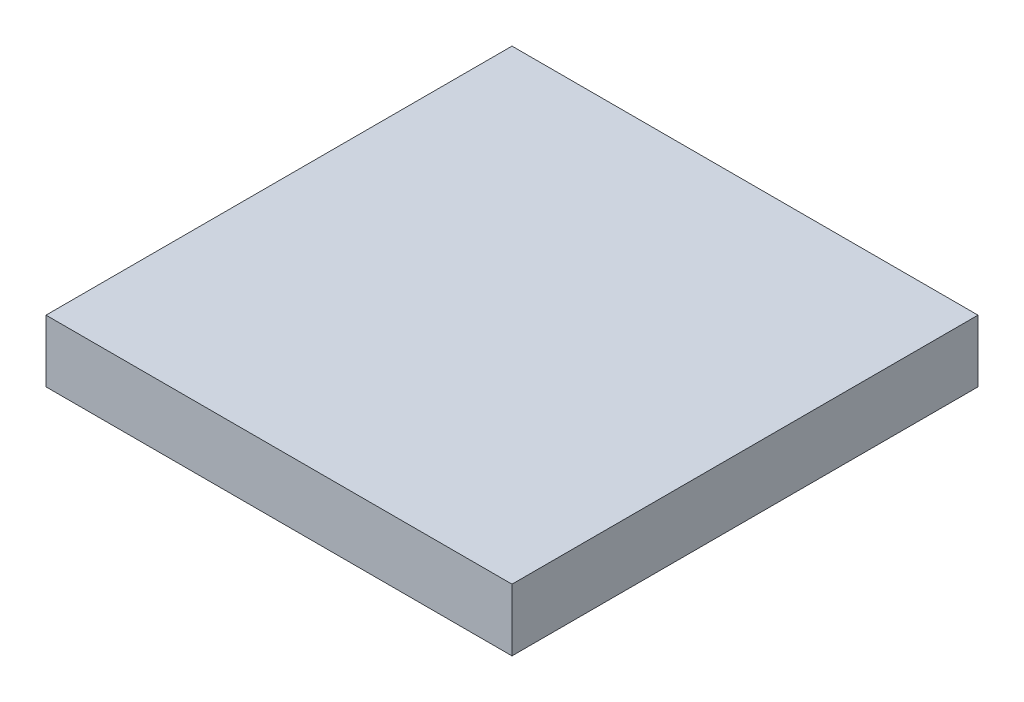
from build123d import *

# Parameters (mm, degrees)
SKETCH1_W           = 15
SKETCH1_H           = 15
BOSS_EXTRUDE1_DEPTH = 2
SKETCH4_W           = 1.6
SKETCH4_H           = 3
BOSS_EXTRUDE2_DEPTH = 2


with BuildPart() as part:
    # Sketch1 → Boss-Extrude1 (new body)
    with BuildSketch(Plane(origin=(0, 0, 0), x_dir=(1, 0, 0), z_dir=(0, 1, 0))):
        with Locations((-0.107629188, -0.080708285)):
            Rectangle(SKETCH1_W, SKETCH1_H)
    extrude(amount=BOSS_EXTRUDE1_DEPTH)

    # Sketch4 → Boss-Extrude2 (add)
    with BuildSketch(Plane(origin=(0, 0, 0), x_dir=(1, 0, 0), z_dir=(0, 1, 0))):
        with Locations((3.392370812, -0.080708285)):
            Rectangle(SKETCH4_W, SKETCH4_H)
        with Locations((-3.607629188, -0.080708285)):
            Rectangle(SKETCH4_W, SKETCH4_H)
    extrude(amount=-BOSS_EXTRUDE2_DEPTH)


solid = part.part
